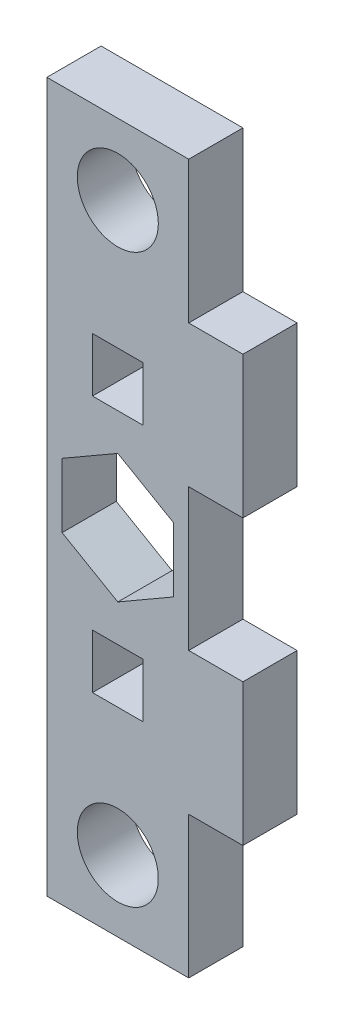
from build123d import *

# Parameters (mm, degrees)
MODEL_R             = 4
MODEL_W             = 5
MODEL_H             = 5.35
BOSS_EXTRUDE1_DEPTH = 5.35


with BuildPart() as part:
    # Model → Boss-Extrude1 (new body)
    with BuildSketch(Plane.XY):
        Polygon((0, 0), (14, 0), (14, 14), (19.35, 14), (19.35, 28), (14, 28), (14, 42), (19.35, 42), (19.35, 56), (14, 56), (14, 70), (0, 70), align=None)
        with Locations((7, 63)):
            Circle(MODEL_R, mode=Mode.SUBTRACT)
        with Locations(Location((7, 7, 0), (0, 0, 180))):
            Circle(MODEL_R, mode=Mode.SUBTRACT)
        with Locations((7, 47.675)):
            Rectangle(MODEL_W, MODEL_H, mode=Mode.SUBTRACT)
        with Locations((7, 22.325)):
            Rectangle(MODEL_W, MODEL_H, mode=Mode.SUBTRACT)
        Polygon((1.500738686, 38.175), (1.500738686, 31.825), (7, 28.65), (12.499261314, 31.825), (12.499261314, 38.175), (7, 41.35), align=None, mode=Mode.SUBTRACT)
    extrude(amount=BOSS_EXTRUDE1_DEPTH)


solid = part.part
